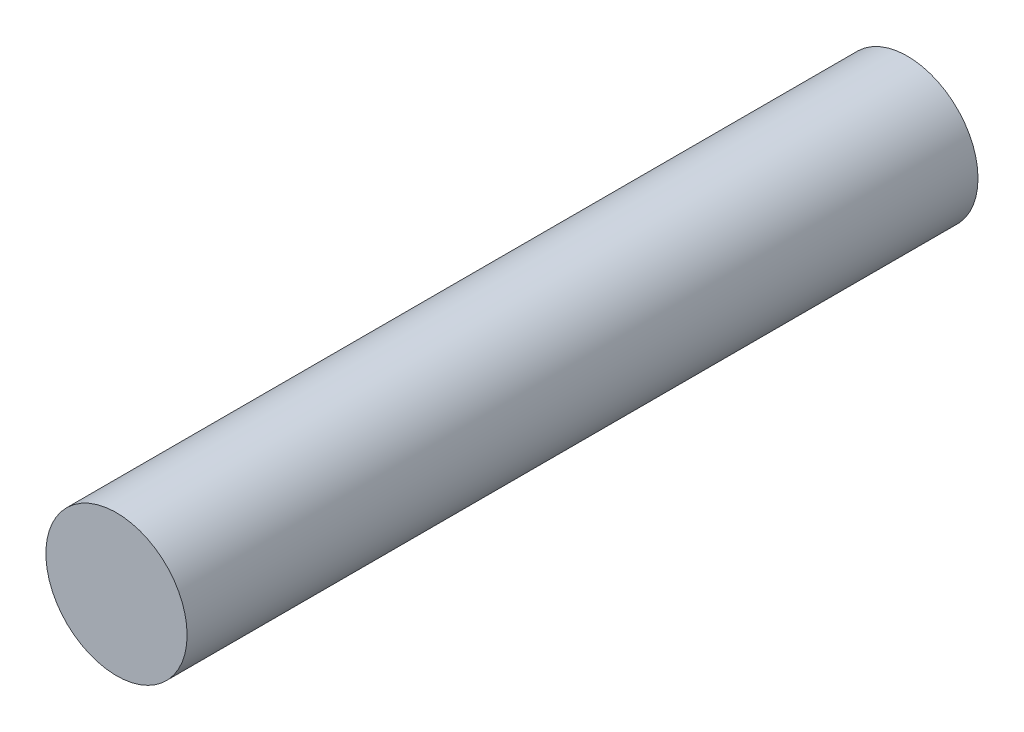
from build123d import *

# Parameters (mm, degrees)
SKETCH_1_R      = 2.5
EXTRUDE_1_DEPTH = 28


with BuildPart() as part:
    # 草图1 → 凸台-拉伸1 (new body)
    with BuildSketch(Plane.XY):
        Circle(SKETCH_1_R)
    extrude(amount=EXTRUDE_1_DEPTH)


solid = part.part
